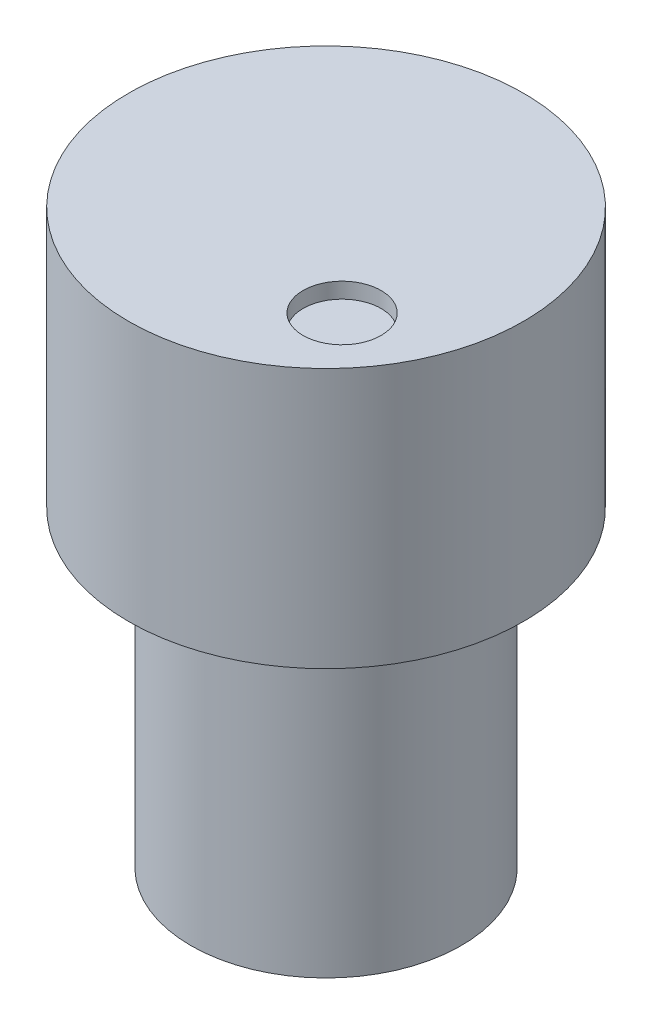
from build123d import *

# Parameters (mm, degrees)
SKETCH1_R           = 5.2
SKETCH1_R_2         = 3.2
BOSS_EXTRUDE1_DEPTH = 12
SKETCH2_R           = 7.6
BOSS_EXTRUDE2_DEPTH = 10
BOSS_EXTRUDE4_START = 5
BOSS_EXTRUDE4_DEPTH = 5
SKETCH5_R           = 1.5
CUT_EXTRUDE1_DEPTH  = 0.6


with BuildPart() as part:
    # Sketch1 → Boss-Extrude1 (new body)
    with BuildSketch(Plane(origin=(0, 0, 0), x_dir=(1, 0, 0), z_dir=(0, 1, 0))):
        with Locations(Location((0, 0, 0), (0, 0, 270))):
            Circle(SKETCH1_R)
        with Locations(Location((0, 0, 0), (0, 0, 270))):
            Circle(SKETCH1_R_2, mode=Mode.SUBTRACT)
    extrude(amount=BOSS_EXTRUDE1_DEPTH)

    # Sketch2 → Boss-Extrude2 (add)
    with BuildSketch(Plane(origin=(0, 12, 0), x_dir=(1, 0, 0), z_dir=(0, 1, 0))):
        with Locations(Location((0, 0, 0), (0, 0, 270))):
            Circle(SKETCH2_R)
    extrude(amount=BOSS_EXTRUDE2_DEPTH)

    # Sketch4 → Boss-Extrude4 (add)
    with BuildSketch(Plane.XZ.offset(-12).offset(BOSS_EXTRUDE4_START)):
        with BuildLine():
            Line((2.645751311, -1.8), (-2.645751311, -1.8))
            ThreePointArc((-2.645751311, -1.8), (0, -3.2), (2.645751311, -1.8))
        make_face()
    extrude(amount=-BOSS_EXTRUDE4_DEPTH)

    # Sketch5 → Cut-Extrude1 (cut)
    with BuildSketch(Plane(origin=(0, 22, 0), x_dir=(1, 0, 0), z_dir=(0, 1, 0))):
        with Locations(Location((3.830222216, -3.213938048, 0), (0, 0, 270))):
            Circle(SKETCH5_R)
    extrude(amount=-CUT_EXTRUDE1_DEPTH, mode=Mode.SUBTRACT)


solid = part.part
